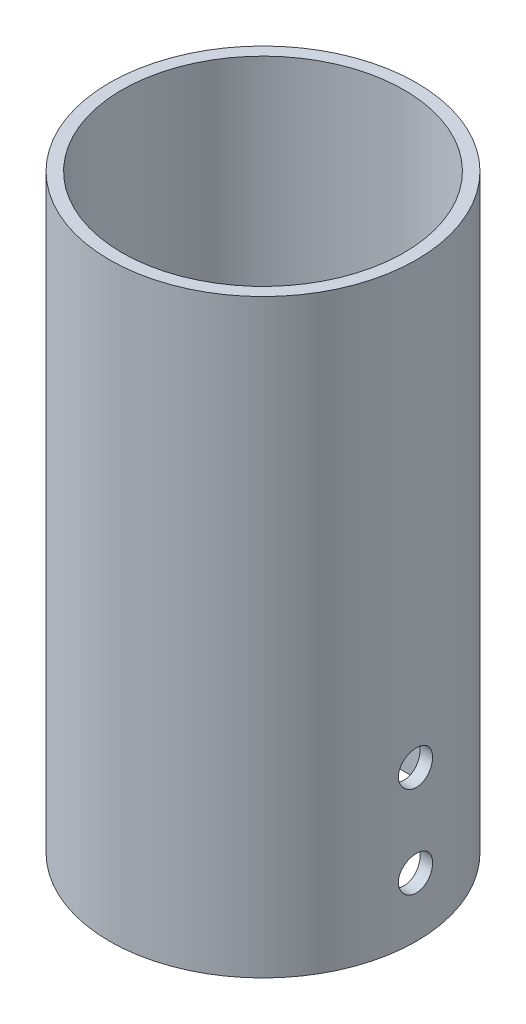
from build123d import *

# Parameters (mm, degrees)
SKETCH1_R               = 26
SKETCH1_R_2             = 23.9
BOSS_EXTRUDE1_DEPTH     = 100
CUT_EXTRUDE1_DEPTH      = 107.545764815
CUT_EXTRUDE1_DEPTH_BACK = 107.545764815
SKETCH2_R               = 2.9


with BuildPart() as part:
    # Sketch1 → Boss-Extrude1 (new body)
    with BuildSketch(Plane(origin=(0, 0, 0), x_dir=(1, 0, 0), z_dir=(0, 1, 0))):
        with Locations(Location((0, 0, 0), (0, 0, 270))):
            Circle(SKETCH1_R)
        with Locations(Location((0, 0, 0), (0, 0, 270))):
            Circle(SKETCH1_R_2, mode=Mode.SUBTRACT)
    extrude(amount=BOSS_EXTRUDE1_DEPTH)

    # Sketch2 → Cut-Extrude1 (cut, two sides: drawn at the far end of the back side and taken through both)
    with BuildSketch(Plane(origin=(0, 0, 0), x_dir=(0, 0, -1), z_dir=(1, 0, 0)).offset(-CUT_EXTRUDE1_DEPTH_BACK)):
        with Locations((0, 10)):
            Circle(SKETCH2_R)
        with Locations((0, 25.5)):
            Circle(SKETCH2_R)
    extrude(amount=CUT_EXTRUDE1_DEPTH + CUT_EXTRUDE1_DEPTH_BACK, mode=Mode.SUBTRACT)


solid = part.part
